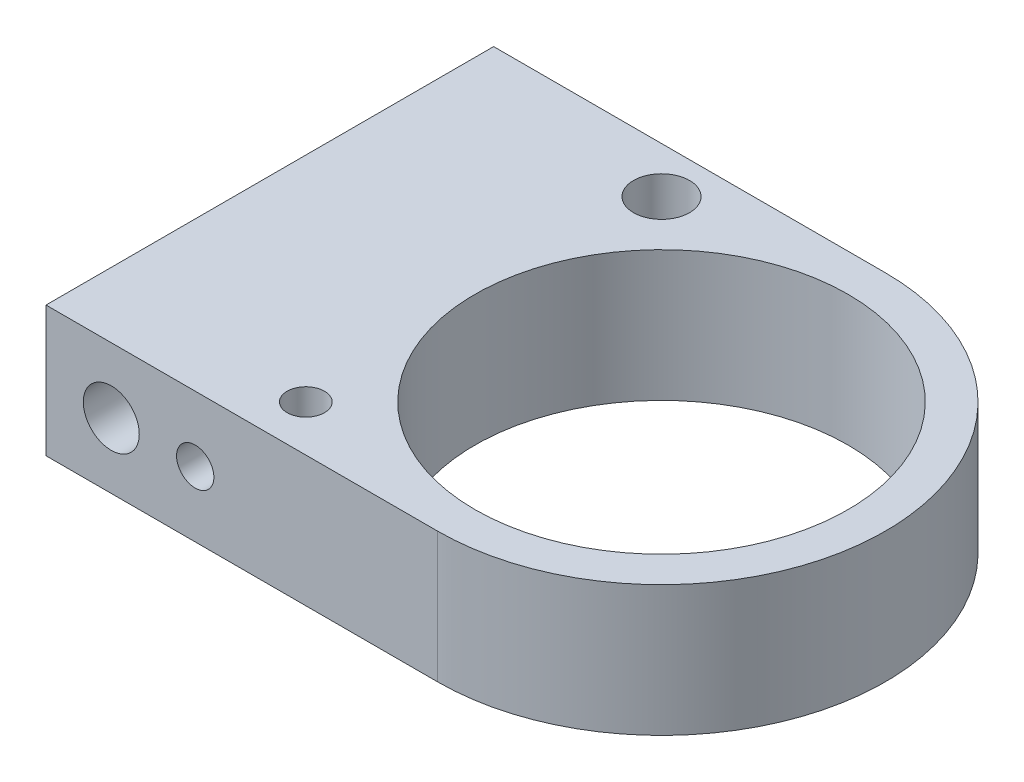
from build123d import *

# Parameters (mm, degrees)
SKETCH_1_W               = 1
SKETCH_1_H               = 12
SKETCH_1_W_2             = 1.5
SKETCH_1_R               = 6
SKETCH_1_R_2             = 5
EXTRUDE_1_DEPTH          = 3.5
CUT_EXTRUDE_1_DEPTH      = 17.324827717
CUT_EXTRUDE_1_DEPTH_BACK = 17.324827717
SKETCH_2_R               = 0.75
SKETCH_2_R_2             = 0.5
SKETCH_3_R               = 0.75
SKETCH_3_R_2             = 0.5
CUT_EXTRUDE_2_DEPTH      = 3.5


with BuildPart() as part:
    # Эскиз1 → Бобышка-Вытянуть1 (new body)
    # profile 1 of 7: a face of its own
    with BuildSketch(Plane(origin=(0, 0, 0), x_dir=(1, 0, 0), z_dir=(0, 1, 0))):
        with Locations((-10, 0)):
            Rectangle(SKETCH_1_W, SKETCH_1_H)
    # profile 2 of 7: a face of its own
    with BuildSketch(Plane(origin=(0, 0, 0), x_dir=(1, 0, 0), z_dir=(0, 1, 0))):
        with Locations((-8.75, 0)):
            Rectangle(SKETCH_1_W_2, SKETCH_1_H)
    # profile 3 of 7: a face of its own
    with BuildSketch(Plane(origin=(0, 0, 0), x_dir=(1, 0, 0), z_dir=(0, 1, 0))):
        with Locations((-7.5, 0)):
            Rectangle(SKETCH_1_W, SKETCH_1_H)
    # profile 4 of 7: a face of its own
    with BuildSketch(Plane(origin=(0, 0, 0), x_dir=(1, 0, 0), z_dir=(0, 1, 0))):
        with Locations((-6.5, 0)):
            Rectangle(SKETCH_1_W, SKETCH_1_H)
    # profile 5 of 7: a face of its own
    with BuildSketch(Plane(origin=(0, 0, 0), x_dir=(1, 0, 0), z_dir=(0, 1, 0))):
        with BuildLine():
            Line((-6, -5e-09), (-6, -6))
            Line((-6, -6), (0, -6))
            ThreePointArc((0, -6), (-4.242640685, -4.242640689), (-6, -5e-09))
        make_face()
    # profile 6 of 7: a face of its own
    with BuildSketch(Plane(origin=(0, 0, 0), x_dir=(1, 0, 0), z_dir=(0, 1, 0))):
        Circle(SKETCH_1_R)
        with Locations(Location((0, 0, 0), (0, 0, 270))):
            Circle(SKETCH_1_R_2, mode=Mode.SUBTRACT)
    # profile 7 of 7: a face of its own
    with BuildSketch(Plane(origin=(0, 0, 0), x_dir=(1, 0, 0), z_dir=(0, 1, 0))):
        with BuildLine():
            Line((-6, 6), (-6, -5e-09))
            ThreePointArc((-6, -5e-09), (-4.242640689, 4.242640685), (0, 6))
            Line((0, 6), (-6, 6))
        make_face()
    extrude(amount=EXTRUDE_1_DEPTH)

    # Эскиз2 → Вырез-Вытянуть1 (cut, two sides: drawn at the far end of the back side and taken through both)
    with BuildSketch(Plane.XY.offset(6).offset(-CUT_EXTRUDE_1_DEPTH_BACK)):
        with Locations((-8.75, 1.75)):
            Circle(SKETCH_2_R)
        with Locations((-6.5, 1.75)):
            Circle(SKETCH_2_R_2)
    extrude(amount=CUT_EXTRUDE_1_DEPTH + CUT_EXTRUDE_1_DEPTH_BACK, mode=Mode.SUBTRACT)

    # Эскиз3 → Вырез-Вытянуть2 (cut)
    with BuildSketch(Plane(origin=(0, 3.5, 0), x_dir=(1, 0, 0), z_dir=(0, 1, 0))):
        with Locations(Location((-4.767766953, 4.767766953, 0), (0, 0, 270))):
            Circle(SKETCH_3_R)
        with Locations(Location((-4.767766953, -4.767766953, 0), (0, 0, 90))):
            Circle(SKETCH_3_R_2)
    extrude(amount=-CUT_EXTRUDE_2_DEPTH, mode=Mode.SUBTRACT)


solid = part.part
